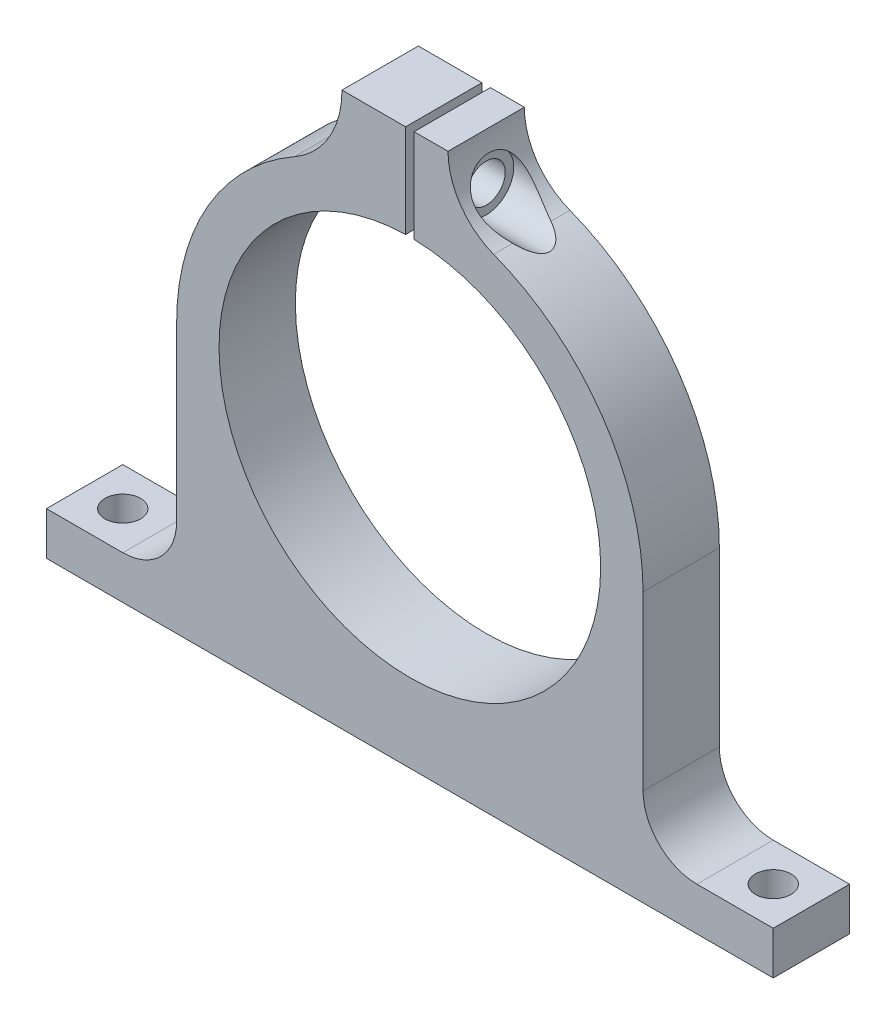
from build123d import *

# Parameters (mm, degrees)
MAIN_BODY_DEPTH               = 18
SKETCH10_R                    = 6.5
HEAD_COUNTERBORE_DEPTH        = 18
TO_TABLE_M8_CLEARANCE_HOLE1_D = 8.4
SKETCH19_W                    = 3.4
SKETCH19_H                    = 84.7
M8_CLEARANCE_HOLE2_REACH      = 119.393
M8_CLEARANCE_HOLE2_BORE_R     = 4.5


with BuildPart() as part:
    # Sketch1 → main body (new body)
    with BuildSketch(Plane.XY):
        with BuildLine():
            Line((85.7, -53.34), (85.7, -63.5))
            Line((85.7, -63.5), (-85.7, -63.5))
            Line((-85.7, -63.5), (-85.7, -53.34))
            Line((-85.7, -53.34), (-67.7, -53.34))
            ThreePointArc((-67.7, -53.34), (-58.719743879, -49.620256121), (-55, -40.64))
            Line((-55, -40.64), (-55, 0))
            ThreePointArc((-55, 0), (-47.533550635, 27.668783205), (-27.161397671, 47.825291181))
            ThreePointArc((-27.161397671, 47.825291181), (-18.99354147, 55.906688319), (-16, 67))
            Line((-16, 67), (-1, 67))
            Line((-1, 67), (-1, 44.988887517))
            ThreePointArc((-1, 44.988887517), (0, -45), (1, 44.988887517))
            Line((1, 44.988887517), (1, 67))
            Line((1, 67), (9, 67))
            ThreePointArc((9, 67), (11.948921757, 57.494782102), (19.76003028, 51.327781983))
            ThreePointArc((19.76003028, 51.327781983), (45.342042661, 31.130357648), (55, 0))
            Line((55, 0), (55, -40.64))
            ThreePointArc((55, -40.64), (58.719743879, -49.620256121), (67.7, -53.34))
            Line((67.7, -53.34), (85.7, -53.34))
        make_face()
    extrude(amount=MAIN_BODY_DEPTH)

    # Sketch10 → head counterbore (cut)
    with BuildSketch(Plane.ZY.offset(-9)):
        with Locations((9, 55.994443758)):
            Circle(SKETCH10_R)
    extrude(amount=-HEAD_COUNTERBORE_DEPTH, mode=Mode.SUBTRACT)

    # to table M8 Clearance Hole1 (through all)
    with Locations(Plane(origin=(0, -53.34, 0), x_dir=(1, 0, 0), z_dir=(0, 1, 0))):
        with Locations((-76.7, -9), (76.7, -9)):
            Hole(TO_TABLE_M8_CLEARANCE_HOLE1_D / 2)

    # Sketch19 → M8x1.25 Tapped Hole1 (revolve, cut)
    with BuildSketch(Plane(origin=(-1, 55.994443758, 9), x_dir=(0, 0, -1), z_dir=(0, 1, 0))):
        with Locations((1.7, 42.35)):
            Rectangle(SKETCH19_W, SKETCH19_H)
    revolve(axis=Axis((5.35, 55.994443758, 9), (-1, 0, 0)), mode=Mode.SUBTRACT)

    # M8 Clearance Hole2 bore → M8 Clearance Hole2 (cut, up to next)
    with BuildSketch(Plane(origin=(9, 0, 0), x_dir=(0, 0, 1), z_dir=(1, 0, 0)), mode=Mode.PRIVATE) as m8_clearance_hole2_sk1:
        with Locations((9, -55.994443758)):
            Circle(M8_CLEARANCE_HOLE2_BORE_R)
    m8_clearance_hole2_tool1 = extrude(m8_clearance_hole2_sk1.sketch, amount=-M8_CLEARANCE_HOLE2_REACH, mode=Mode.PRIVATE) & part.part
    add(m8_clearance_hole2_tool1.solids().sort_by_distance((9, 55.994444, 9))[0], mode=Mode.SUBTRACT)


solid = part.part
